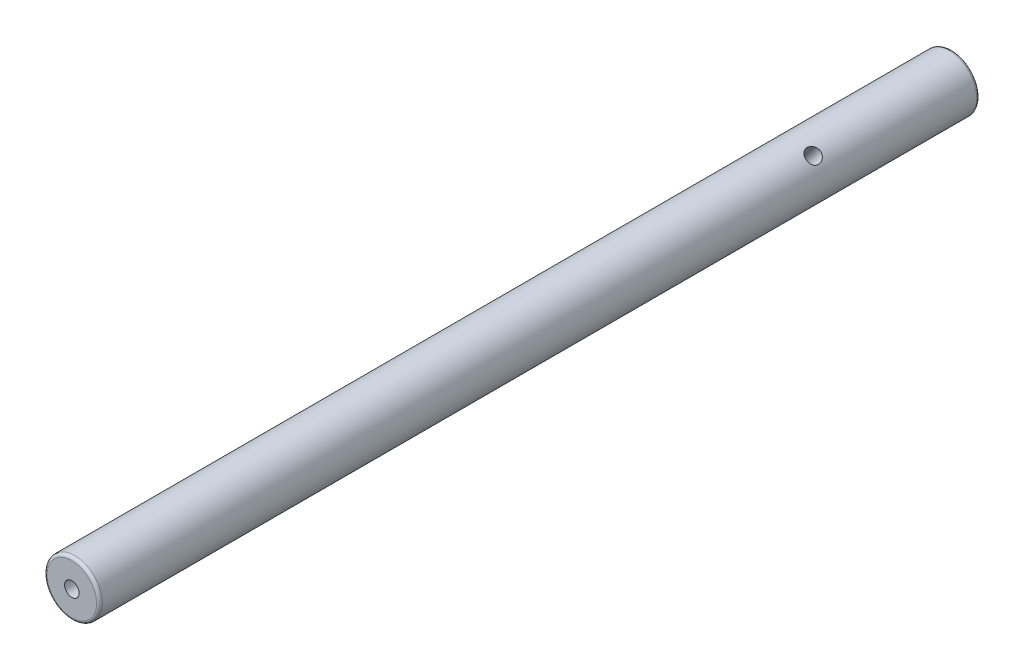
from build123d import *

# Parameters (mm, degrees)
ESBO_O1_R                                      = 4.7625
RESSALTO_EXTRUS_O1_DEPTH                       = 151.9
FURO_ROSCADO_DE_M5X0_81_D                      = 4.2
FURO_ROSCADO_DE_M5X0_81_DEPTH                  = 14
FURO_ROSCADO_DE_M5X0_81_TIP                    = 1.2618073
FILETE1_R                                      = 0.5
BROCA_DE_ROSQUEAR_PARA_TARRAXA_DE_M3X0_5_D     = 2.5
BROCA_DE_ROSQUEAR_PARA_TARRAXA_DE_M3X0_5_DEPTH = 5
BROCA_DE_ROSQUEAR_PARA_TARRAXA_DE_M3X0_5_TIP   = 0.751075774
FILETE2_R                                      = 0.5
BROCA_DE_ROSQUEAR_PARA_TARRAXA_DE_M3_2_D       = 2.5
BROCA_DE_ROSQUEAR_PARA_TARRAXA_DE_M3_2_DEPTH   = 10
BROCA_DE_ROSQUEAR_PARA_TARRAXA_DE_M3_2_TIP     = 0.751075774


with BuildPart() as part:
    # Esboço1 → Ressalto-extrusão1 (new body)
    with BuildSketch(Plane.XY):
        with Locations((21.9, 0.462441068)):
            Circle(ESBO_O1_R)
    extrude(amount=RESSALTO_EXTRUS_O1_DEPTH)

    # Furo roscado de M5x0.81
    with Locations(Plane(origin=(0, 0, 0), x_dir=(-1, 0, 0), z_dir=(0, 0, -1))):
        with Locations((-21.9, 0.462441068)):
            Hole(FURO_ROSCADO_DE_M5X0_81_D / 2, depth=FURO_ROSCADO_DE_M5X0_81_DEPTH)
            with Locations((0, 0, -(FURO_ROSCADO_DE_M5X0_81_DEPTH + FURO_ROSCADO_DE_M5X0_81_TIP / 2))):  # 118° drill point
                Cone(0, FURO_ROSCADO_DE_M5X0_81_D / 2, FURO_ROSCADO_DE_M5X0_81_TIP, mode=Mode.SUBTRACT)

    # Filete1
    filete1_edges = [part.edges().sort_by_distance(p)[0] for p in [
        (17.1375, 0.462441068, 0),
    ]]
    fillet(filete1_edges, radius=FILETE1_R)

    # Broca de rosquear para tarraxa de M3x0.5
    with Locations(Plane.XY.offset(151.9)):
        with Locations((21.9, 0.462441068)):
            Hole(BROCA_DE_ROSQUEAR_PARA_TARRAXA_DE_M3X0_5_D / 2, depth=BROCA_DE_ROSQUEAR_PARA_TARRAXA_DE_M3X0_5_DEPTH)
            with Locations((0, 0, -(BROCA_DE_ROSQUEAR_PARA_TARRAXA_DE_M3X0_5_DEPTH + BROCA_DE_ROSQUEAR_PARA_TARRAXA_DE_M3X0_5_TIP / 2))):  # 118° drill point
                Cone(0, BROCA_DE_ROSQUEAR_PARA_TARRAXA_DE_M3X0_5_D / 2, BROCA_DE_ROSQUEAR_PARA_TARRAXA_DE_M3X0_5_TIP, mode=Mode.SUBTRACT)

    # Filete2
    filete2_edges = [part.edges().sort_by_distance(p)[0] for p in [
        (17.1375, 0.462441068, 151.9),
    ]]
    fillet(filete2_edges, radius=FILETE2_R)

    # Broca de rosquear para tarraxa de M3 2
    with Locations(Plane(origin=(18.970347391, -3.292361436, 26.879843119), x_dir=(-0.78840997447, 0.615150154154, 0), z_dir=(-0.615150154154, -0.78840997447, 0))):
        with Locations((0, 0)):
            Hole(BROCA_DE_ROSQUEAR_PARA_TARRAXA_DE_M3_2_D / 2, depth=BROCA_DE_ROSQUEAR_PARA_TARRAXA_DE_M3_2_DEPTH)
            with Locations((0, 0, -(BROCA_DE_ROSQUEAR_PARA_TARRAXA_DE_M3_2_DEPTH + BROCA_DE_ROSQUEAR_PARA_TARRAXA_DE_M3_2_TIP / 2))):  # 118° drill point
                Cone(0, BROCA_DE_ROSQUEAR_PARA_TARRAXA_DE_M3_2_D / 2, BROCA_DE_ROSQUEAR_PARA_TARRAXA_DE_M3_2_TIP, mode=Mode.SUBTRACT)


solid = part.part
